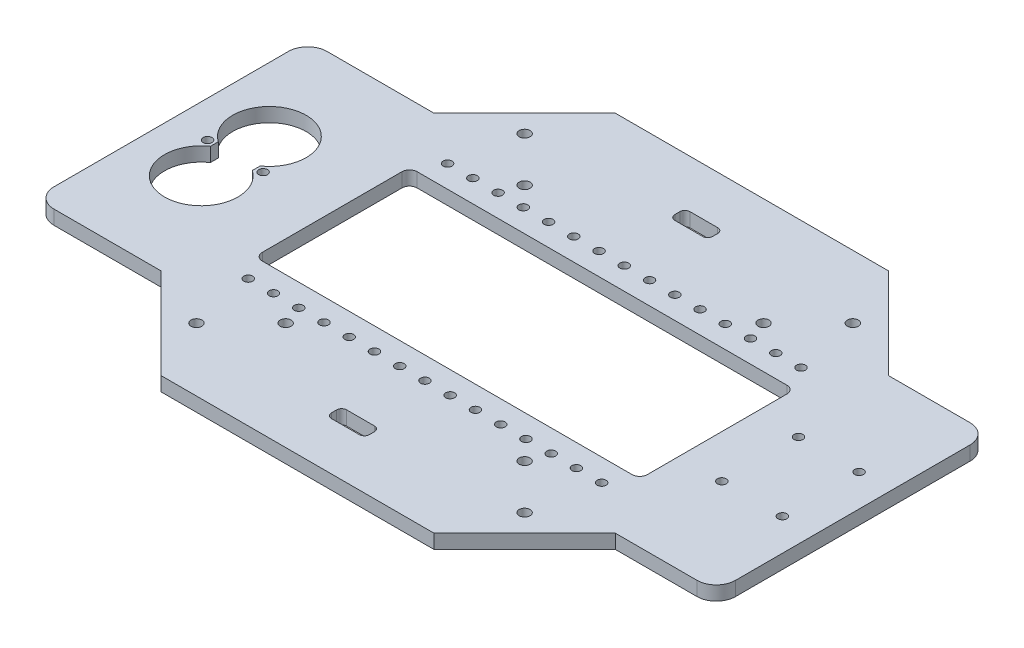
from build123d import *

# Parameters (mm, degrees)
BOSS_EXTRUDE1_DEPTH = 5.588
SKETCH2_R           = 2.159
CUT_EXTRUDE1_DEPTH  = 158.413946399
SKETCH3_W           = 152.51
SKETCH3_H           = 61.34
CUT_EXTRUDE2_DEPTH  = 158.413946399
BOSS_EXTRUDE2_DEPTH = 5.588
BOSS_EXTRUDE3_DEPTH = 5.588
SKETCH7_R           = 1.75
CUT_EXTRUDE4_DEPTH  = 187.865769606
SKETCH8_R           = 1.75
CUT_EXTRUDE6_DEPTH  = 187.865769606
SKETCH9_R           = 1.75
CUT_EXTRUDE8_DEPTH  = 187.865769606
CUT_EXTRUDE9_DEPTH  = 187.865769606
FILLET1_R           = 3


with BuildPart() as part:
    # Sketch1 → Boss-Extrude1 (new body)
    with BuildSketch(Plane(origin=(0, 0, 0), x_dir=(1, 0, 0), z_dir=(0, 1, 0))):
        Polygon((-73.254183378, 28.522688753), (-37.333158894, 64.443713237), (70.824792138, 64.443713237), (106.745816622, 28.522688753), (106.745816622, -79.635262279), (70.824792138, -115.556286763), (-37.333158894, -115.556286763), (-73.254183378, -79.635262279), align=None)
    extrude(amount=BOSS_EXTRUDE1_DEPTH)

    # Sketch2 → Cut-Extrude1 (cut, through all)
    with BuildSketch(Plane(origin=(0, 5.588, 0), x_dir=(1, 0, 0), z_dir=(0, 1, 0))):
        with Locations(Location((-48.254183378, 39.443713237, 0), (0, 0, 270))):
            Circle(SKETCH2_R)
        with Locations(Location((-30.576513848, 21.766043708, 0), (0, 0, 270))):
            Circle(SKETCH2_R)
        with Locations(Location((-48.254183378, -90.556286763, 0), (0, 0, 270))):
            Circle(SKETCH2_R)
        with Locations(Location((-30.576513848, -72.878617233, 0), (0, 0, 270))):
            Circle(SKETCH2_R)
        with Locations(Location((64.068147093, 21.766043708, 0), (0, 0, 270))):
            Circle(SKETCH2_R)
        with Locations(Location((81.745816622, 39.443713237, 0), (0, 0, 270))):
            Circle(SKETCH2_R)
        with Locations(Location((64.068147093, -72.878617233, 0), (0, 0, 270))):
            Circle(SKETCH2_R)
        with Locations(Location((81.745816622, -90.556286763, 0), (0, 0, 270))):
            Circle(SKETCH2_R)
    extrude(amount=-CUT_EXTRUDE1_DEPTH, mode=Mode.SUBTRACT)

    # Sketch3 → Cut-Extrude2 (cut, through all)
    with BuildSketch(Plane(origin=(0, 5.588, 0), x_dir=(1, 0, 0), z_dir=(0, 1, 0))):
        with Locations((16.745816622, -25.556286763)):
            Rectangle(SKETCH3_W, SKETCH3_H)
    extrude(amount=-CUT_EXTRUDE2_DEPTH, mode=Mode.SUBTRACT)

    # Sketch5 → Boss-Extrude2 (add)
    with BuildSketch(Plane(origin=(0, 5.588, 0), x_dir=(1, 0, 0), z_dir=(0, 1, 0))):
        with BuildLine():
            Line((-73.254183378, -79.635262279), (-115.634183378, -79.635262279))
            ThreePointArc((-115.634183378, -79.635262279), (-121.02233705, -77.403415951), (-123.254183378, -72.015262279))
            Line((-123.254183378, -72.015262279), (-123.254183378, 20.902688753))
            ThreePointArc((-123.254183378, 20.902688753), (-121.02233705, 26.290842426), (-115.634183378, 28.522688753))
            Line((-115.634183378, 28.522688753), (-73.254183378, 28.522688753))
            Line((-73.254183378, 28.522688753), (-73.254183378, -79.635262279))
        make_face()
    extrude(amount=-BOSS_EXTRUDE2_DEPTH)

    # Sketch6 → Boss-Extrude3 (add)
    with BuildSketch(Plane(origin=(0, 5.588, 0), x_dir=(1, 0, 0), z_dir=(0, 1, 0))):
        with BuildLine():
            Line((106.745816622, 28.522688753), (139.125816622, 28.522688753))
            ThreePointArc((139.125816622, 28.522688753), (144.513970295, 26.290842426), (146.745816622, 20.902688753))
            Line((146.745816622, 20.902688753), (146.745816622, -72.015262279))
            ThreePointArc((146.745816622, -72.015262279), (144.513970295, -77.403415951), (139.125816622, -79.635262279))
            Line((139.125816622, -79.635262279), (106.745816622, -79.635262279))
            Line((106.745816622, -79.635262279), (106.745816622, 28.522688753))
        make_face()
    extrude(amount=-BOSS_EXTRUDE3_DEPTH)

    # Sketch7 → Cut-Extrude4 (cut, through all)
    with BuildSketch(Plane(origin=(0, 5.588, 0), x_dir=(1, 0, 0), z_dir=(0, 1, 0))):
        with Locations(Location((110.045816622, -10.356286763, 0), (0, 0, 270))):
            Circle(SKETCH7_R)
        with Locations(Location((134.045816622, -10.356286763, 0), (0, 0, 270))):
            Circle(SKETCH7_R)
        with Locations(Location((110.045816622, -40.756286763, 0), (0, 0, 270))):
            Circle(SKETCH7_R)
        with Locations(Location((134.045816622, -40.756286763, 0), (0, 0, 270))):
            Circle(SKETCH7_R)
    extrude(amount=-CUT_EXTRUDE4_DEPTH, mode=Mode.SUBTRACT)

    # Sketch8 → Cut-Extrude6 (cut, through all)
    with BuildSketch(Plane(origin=(0, 5.588, 0), x_dir=(1, 0, 0), z_dir=(0, 1, 0))):
        with Locations(Location((-108.854183378, -25.556286763, 0), (0, 0, 270))):
            Circle(SKETCH8_R)
        with Locations(Location((-86.854183378, -25.556286763, 0), (0, 0, 270))):
            Circle(SKETCH8_R)
        with BuildLine():
            Line((-106.154183378, -24.006705166), (-106.154183378, -27.10586836))
            ThreePointArc((-106.154183378, -27.10586836), (-97.854183378, -53.606286763), (-89.554183378, -27.10586836))
            Line((-89.554183378, -27.10586836), (-89.554183378, -24.006705166))
            ThreePointArc((-89.554183378, -24.006705166), (-97.854183378, 2.493713237), (-106.154183378, -24.006705166))
        make_face()
    extrude(amount=-CUT_EXTRUDE6_DEPTH, mode=Mode.SUBTRACT)

    # Sketch9 → Cut-Extrude8 (cut, through all)
    with BuildSketch(Plane(origin=(0, 5.588, 0), x_dir=(1, 0, 0), z_dir=(0, 1, 0))):
        with Locations(Location((-53.254183378, 13.923713237, 0), (0, 0, 270))):
            Circle(SKETCH9_R)
        with Locations(Location((-43.254183378, 13.923713237, 0), (0, 0, 270))):
            Circle(SKETCH9_R)
        with Locations(Location((-33.254183378, 13.923713237, 0), (0, 0, 270))):
            Circle(SKETCH9_R)
        with Locations(Location((-23.254183378, 13.923713237, 0), (0, 0, 270))):
            Circle(SKETCH9_R)
        with Locations(Location((-13.254183378, 13.923713237, 0), (0, 0, 270))):
            Circle(SKETCH9_R)
        with Locations(Location((-3.254183378, 13.923713237, 0), (0, 0, 270))):
            Circle(SKETCH9_R)
        with Locations(Location((6.745816622, 13.923713237, 0), (0, 0, 270))):
            Circle(SKETCH9_R)
        with Locations(Location((16.745816622, 13.923713237, 0), (0, 0, 270))):
            Circle(SKETCH9_R)
        with Locations(Location((26.745816622, 13.923713237, 0), (0, 0, 270))):
            Circle(SKETCH9_R)
        with Locations(Location((36.745816622, 13.923713237, 0), (0, 0, 270))):
            Circle(SKETCH9_R)
        with Locations(Location((46.745816622, 13.923713237, 0), (0, 0, 270))):
            Circle(SKETCH9_R)
        with Locations(Location((56.745816622, 13.923713237, 0), (0, 0, 270))):
            Circle(SKETCH9_R)
        with Locations(Location((66.745816622, 13.923713237, 0), (0, 0, 270))):
            Circle(SKETCH9_R)
        with Locations(Location((76.745816622, 13.923713237, 0), (0, 0, 270))):
            Circle(SKETCH9_R)
        with Locations(Location((86.745816622, 13.923713237, 0), (0, 0, 270))):
            Circle(SKETCH9_R)
        with Locations(Location((-53.254183378, -65.036286763, 0), (0, 0, 270))):
            Circle(SKETCH9_R)
        with Locations(Location((-43.254183378, -65.036286763, 0), (0, 0, 270))):
            Circle(SKETCH9_R)
        with Locations(Location((-33.254183378, -65.036286763, 0), (0, 0, 270))):
            Circle(SKETCH9_R)
        with Locations(Location((-23.254183378, -65.036286763, 0), (0, 0, 270))):
            Circle(SKETCH9_R)
        with Locations(Location((-13.254183378, -65.036286763, 0), (0, 0, 270))):
            Circle(SKETCH9_R)
        with Locations(Location((-3.254183378, -65.036286763, 0), (0, 0, 270))):
            Circle(SKETCH9_R)
        with Locations(Location((6.745816622, -65.036286763, 0), (0, 0, 270))):
            Circle(SKETCH9_R)
        with Locations(Location((16.745816622, -65.036286763, 0), (0, 0, 270))):
            Circle(SKETCH9_R)
        with Locations(Location((26.745816622, -65.036286763, 0), (0, 0, 270))):
            Circle(SKETCH9_R)
        with Locations(Location((36.745816622, -65.036286763, 0), (0, 0, 270))):
            Circle(SKETCH9_R)
        with Locations(Location((46.745816622, -65.036286763, 0), (0, 0, 270))):
            Circle(SKETCH9_R)
        with Locations(Location((56.745816622, -65.036286763, 0), (0, 0, 270))):
            Circle(SKETCH9_R)
        with Locations(Location((66.745816622, -65.036286763, 0), (0, 0, 270))):
            Circle(SKETCH9_R)
        with Locations(Location((76.745816622, -65.036286763, 0), (0, 0, 270))):
            Circle(SKETCH9_R)
        with Locations(Location((86.745816622, -65.036286763, 0), (0, 0, 270))):
            Circle(SKETCH9_R)
    extrude(amount=-CUT_EXTRUDE8_DEPTH, mode=Mode.SUBTRACT)

    # Sketch10 → Cut-Extrude9 (cut, through all)
    with BuildSketch(Plane(origin=(0, 5.588, 0), x_dir=(1, 0, 0), z_dir=(0, 1, 0))):
        with BuildLine():
            Line((11.245816622, 45.443713237), (22.245816622, 45.443713237))
            ThreePointArc((22.245816622, 45.443713237), (23.660030185, 44.8579268), (24.245816622, 43.443713237))
            Line((24.245816622, 43.443713237), (24.245816622, 41.443713237))
            ThreePointArc((24.245816622, 41.443713237), (23.660030185, 40.029499675), (22.245816622, 39.443713237))
            Line((22.245816622, 39.443713237), (11.245816622, 39.443713237))
            ThreePointArc((11.245816622, 39.443713237), (9.83160306, 40.029499675), (9.245816622, 41.443713237))
            Line((9.245816622, 41.443713237), (9.245816622, 43.443713237))
            ThreePointArc((9.245816622, 43.443713237), (9.83160306, 44.8579268), (11.245816622, 45.443713237))
        make_face()
        with BuildLine():
            Line((11.245816622, -90.556286763), (22.245816622, -90.556286763))
            ThreePointArc((22.245816622, -90.556286763), (23.660030185, -91.1420732), (24.245816622, -92.556286763))
            Line((24.245816622, -92.556286763), (24.245816622, -94.556286763))
            ThreePointArc((24.245816622, -94.556286763), (23.660030185, -95.970500325), (22.245816622, -96.556286763))
            Line((22.245816622, -96.556286763), (11.245816622, -96.556286763))
            ThreePointArc((11.245816622, -96.556286763), (9.83160306, -95.970500325), (9.245816622, -94.556286763))
            Line((9.245816622, -94.556286763), (9.245816622, -92.556286763))
            ThreePointArc((9.245816622, -92.556286763), (9.83160306, -91.1420732), (11.245816622, -90.556286763))
        make_face()
    extrude(amount=-CUT_EXTRUDE9_DEPTH, mode=Mode.SUBTRACT)

    # Fillet1
    fillet1_edges = [part.edges().sort_by_distance(p)[0] for p in [
        (-59.509183378, 2.794, 56.226286763),
        (-59.509183378, 2.794, -5.113713237),
        (93.000816622, 2.794, -5.113713237),
        (93.000816622, 2.794, 56.226286763),
    ]]
    fillet(fillet1_edges, radius=FILLET1_R)


solid = part.part
